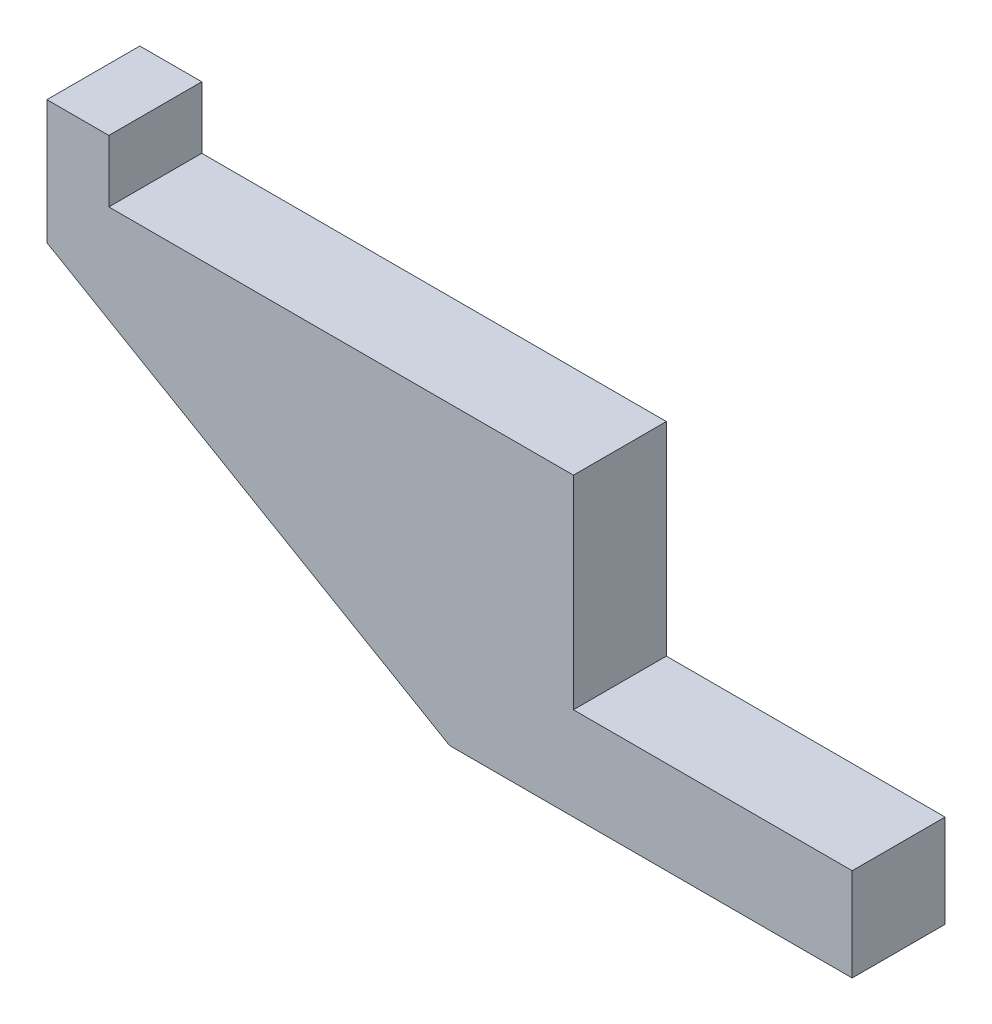
from build123d import *

# Parameters (mm, degrees)
BOSS_EXTRUDE1_DEPTH      = 7.5
BOSS_EXTRUDE1_DEPTH_BACK = 7.5


with BuildPart() as part:
    # Sketch1 → Boss-Extrude1 (new, two sides: drawn at the far end of the back side and taken through both)
    with BuildSketch(Plane.XY.offset(-BOSS_EXTRUDE1_DEPTH_BACK)):
        Polygon((-451.871999052, -4.232779954), (-451.871999052, -19.232779954), (-516.871999052, -19.232779954), (-581.871999052, 18.567220046), (-581.871999052, 38.567220046), (-571.871999052, 38.567220046), (-571.871999052, 28.567220046), (-496.871999052, 28.567220046), (-496.871999052, -4.232779954), align=None)
    extrude(amount=BOSS_EXTRUDE1_DEPTH + BOSS_EXTRUDE1_DEPTH_BACK)


solid = part.part
